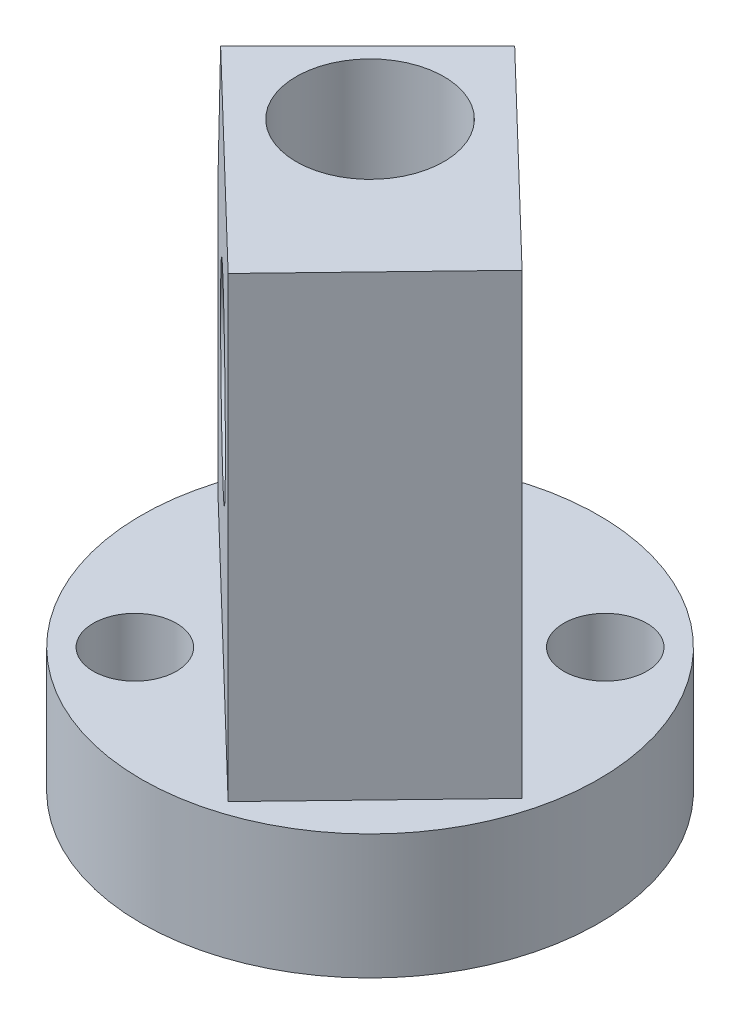
from build123d import *

# Parameters (mm, degrees)
ESQUISSE1_W                                        = 11
ESQUISSE1_H                                        = 6
BOSS_EXTRU_1_DEPTH                                 = 22
DIAM_TRE_DU_PER_AGE_7_1_7_1_1_D                    = 7.1
DIAM_TRE_DU_PER_AGE_7_1_7_1_1_DEPTH                = 6
DIAM_TRE_DU_PER_AGE_8_5_8_5_1_D                    = 8.5
CHAMBRAGE_POUR_VIS_T_TE_HEXAGONALE_M21_D           = 2.5
CHAMBRAGE_POUR_VIS_T_TE_HEXAGONALE_M21_CBORE_D     = 4
CHAMBRAGE_POUR_VIS_T_TE_HEXAGONALE_M21_CBORE_DEPTH = 4.5
DIAM_TRE_DU_PER_AGE_8_0_8_1_D                      = 8
DIAM_TRE_DU_PER_AGE_8_0_8_1_DEPTH                  = 2
DIAM_TRE_DU_PER_AGE_8_0_8_1_TIP                    = 4
CHANFREIN1_SIZE                                    = 9
CHANFREIN1_SIZE2                                   = 4.785384885


with BuildPart() as part:
    # Esquisse1 → Révolution1 (revolve)
    with BuildSketch(Plane(origin=(0, 0, 0), x_dir=(-1, 0, 0), z_dir=(0, 0, -1)), mode=Mode.PRIVATE) as r_volution1_sk:
        with Locations((-5.5, 3)):
            Rectangle(ESQUISSE1_W, ESQUISSE1_H)
    revolve(r_volution1_sk.sketch.rotate(Axis((0, 0, 0), (0, 1, 0)), 270), axis=Axis((0, 0, 0), (0, 1, 0)))

    # Esquisse2 → Boss.-Extru.1 (add)
    with BuildSketch(Plane(origin=(0, 6, 0), x_dir=(-1, 0, 0), z_dir=(0, 1, 0))):
        Polygon((-9.95156463, 2.63938656), (-3.016441782, 9.843834567), (10.088792211, -2.771484138), (3.016441782, -9.843834567), align=None)
    extrude(amount=BOSS_EXTRU_1_DEPTH)

    # Diamètre du perçage Ø7.1 (7.1)1
    with Locations(Plane(origin=(0, 28, 0), x_dir=(1, 0, 0), z_dir=(0, 1, 0))):
        with Locations((0, 0)):
            Hole(DIAM_TRE_DU_PER_AGE_7_1_7_1_1_D / 2, depth=DIAM_TRE_DU_PER_AGE_7_1_7_1_1_DEPTH)

    # Diamètre du perçage Ø8.5 (8.5)1 (through all)
    with Locations(Plane(origin=(-3.467561424, 0, 3.602224003), x_dir=(0.7204448006982934, 0, 0.6935122847843406), z_dir=(-0.6935122847843406, 0, 0.7204448006982934))):
        with Locations((-0.19047619, 17)):
            Hole(DIAM_TRE_DU_PER_AGE_8_5_8_5_1_D / 2)

    # Chambrage pour vis à tête hexagonale M21 (through all)
    with Locations(Plane(origin=(0, 6, 0), x_dir=(1, 0, 0), z_dir=(0, 1, 0))):
        with Locations((5.656854249, 5.656854249), (-5.656854249, -5.656854249)):
            CounterBoreHole(CHAMBRAGE_POUR_VIS_T_TE_HEXAGONALE_M21_D / 2, CHAMBRAGE_POUR_VIS_T_TE_HEXAGONALE_M21_CBORE_D / 2, CHAMBRAGE_POUR_VIS_T_TE_HEXAGONALE_M21_CBORE_DEPTH)

    # Diamètre du perçage Ø8.0 (8)1
    with Locations(Plane(origin=(0, 0, 0), x_dir=(-1, 0, 0), z_dir=(0, -1, 0))):
        with Locations((0, 0)):
            Hole(DIAM_TRE_DU_PER_AGE_8_0_8_1_D / 2, depth=DIAM_TRE_DU_PER_AGE_8_0_8_1_DEPTH)
            with Locations((0, 0, -(DIAM_TRE_DU_PER_AGE_8_0_8_1_DEPTH + DIAM_TRE_DU_PER_AGE_8_0_8_1_TIP / 2))):  # 90° drill point
                Cone(0, DIAM_TRE_DU_PER_AGE_8_0_8_1_D / 2, DIAM_TRE_DU_PER_AGE_8_0_8_1_TIP, mode=Mode.SUBTRACT)

    # Chanfrein1
    chanfrein1_edges = [part.edges().sort_by_distance(p)[0] for p in [
        (-6.552616997, 28, -6.307659352),
    ]]
    chanfrein1_side = [part.faces().sort_by_distance(p)[0] for p in [
        (-6.552616997, 17, -6.307659352),
    ]]
    chamfer(chanfrein1_edges, length=CHANFREIN1_SIZE, length2=CHANFREIN1_SIZE2, reference=chanfrein1_side[0])


solid = part.part
